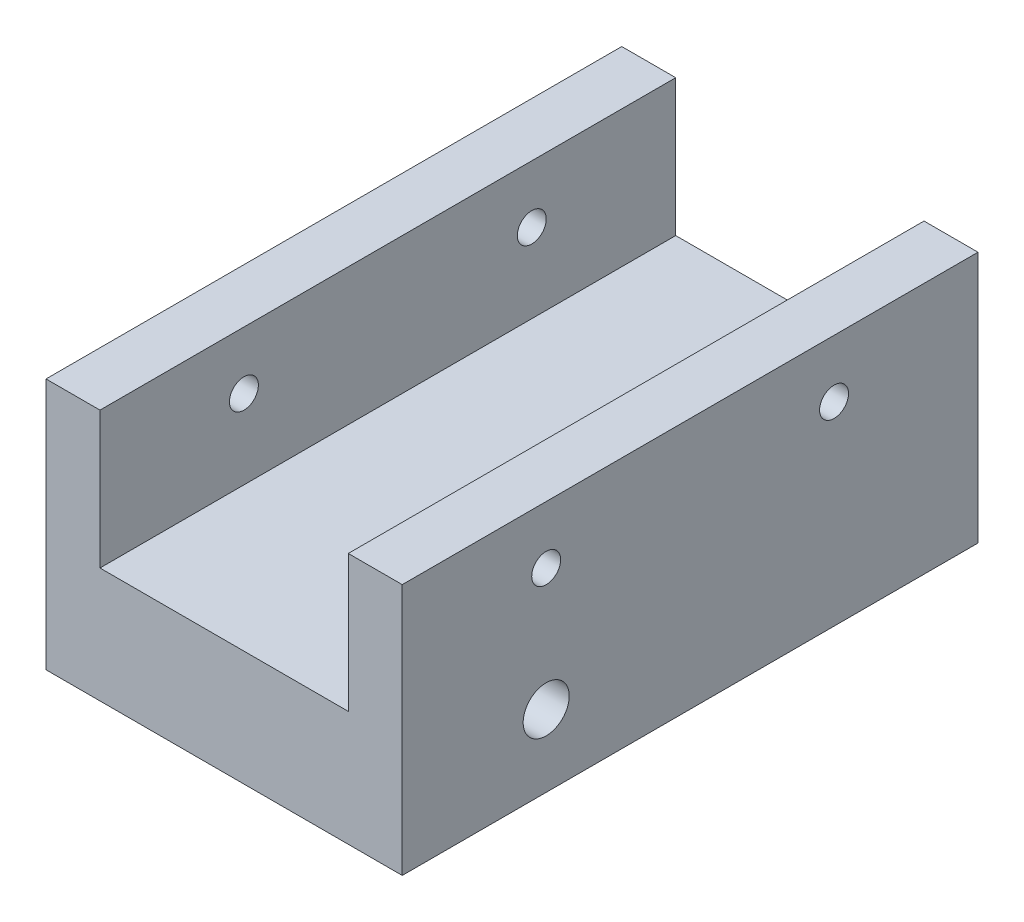
from build123d import *

# Parameters (mm, degrees)
BOSS_EXTRUDE1_DEPTH        = 101.6
F_7_0_201_DIAMETER_HOLE1_D = 5.1054
SKETCH5_R                  = 4.064
CUT_EXTRUDE2_DEPTH         = 128.476941935
SKETCH9_R                  = 3.81
CUT_EXTRUDE3_DEPTH         = 38.1


with BuildPart() as part:
    # Sketch1 → Boss-Extrude1 (new body)
    with BuildSketch(Plane.XY):
        Polygon((0, 0), (62.865, 0), (62.865, 44.45), (53.34, 44.45), (53.34, 20.32), (9.525, 20.32), (9.525, 44.45), (0, 44.45), align=None)
    extrude(amount=BOSS_EXTRUDE1_DEPTH)

    # #7 (0.201) Diameter Hole1 (through all)
    with Locations(Plane.ZY):
        with Locations((25.4, 34.29), (76.2, 34.29)):
            Hole(F_7_0_201_DIAMETER_HOLE1_D / 2)

    # Sketch5 → Cut-Extrude2 (cut, through all)
    with BuildSketch(Plane.ZY):
        with Locations((76.2, 12.7)):
            Circle(SKETCH5_R)
    extrude(amount=-CUT_EXTRUDE2_DEPTH, mode=Mode.SUBTRACT)

    # Sketch9 → Cut-Extrude3 (cut)
    with BuildSketch(Plane(origin=(0, 0, 0), x_dir=(-1, 0, 0), z_dir=(0, 0, -1))):
        with Locations((-31.4325, 12.7)):
            Circle(SKETCH9_R)
    extrude(amount=-CUT_EXTRUDE3_DEPTH, mode=Mode.SUBTRACT)


solid = part.part
